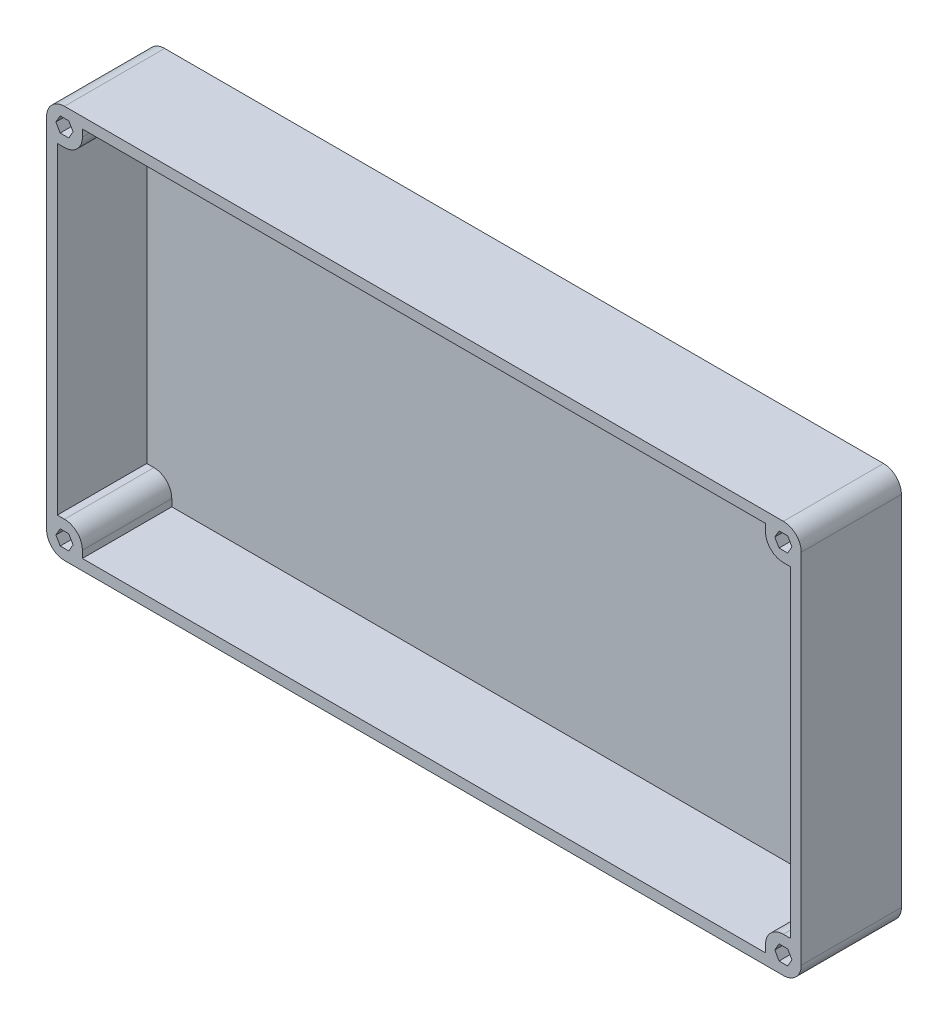
from build123d import *

# Parameters (mm, degrees)
BOSS_EXTRUDE1_DEPTH = 35.56
SHELL1_T            = -3.81
BOSS_EXTRUDE2_REACH = 306.284
SKETCH2_R           = 1.5875
CUT_EXTRUDE1_DEPTH  = 5.08


with BuildPart() as part:
    # Sketch1 → Boss-Extrude1 (new body)
    with BuildSketch(Plane.XY):
        with BuildLine():
            Line((6.35, 0), (261.62, 0))
            ThreePointArc((261.62, 0), (266.110128061, 1.859871939), (267.97, 6.35))
            Line((267.97, 6.35), (267.97, 133.35))
            ThreePointArc((267.97, 133.35), (266.110128061, 137.840128061), (261.62, 139.7))
            Line((261.62, 139.7), (6.35, 139.7))
            ThreePointArc((6.35, 139.7), (1.859871939, 137.840128061), (0, 133.35))
            Line((0, 133.35), (0, 6.35))
            ThreePointArc((0, 6.35), (1.859871939, 1.859871939), (6.35, 0))
        make_face()
    extrude(amount=BOSS_EXTRUDE1_DEPTH)

    # Shell1
    shell1_openings = [part.faces().sort_by_distance(p)[0] for p in [
        (133.985, 69.85, 35.56),
    ]]
    offset(amount=SHELL1_T, openings=shell1_openings, kind=Kind.INTERSECTION)

    # Sketch2 → Boss-Extrude2 (add, up to next)
    with BuildSketch(Plane.XY.offset(35.56), mode=Mode.PRIVATE) as boss_extrude2_sk1:
        with BuildLine():
            Line((255.27, 139.7), (261.62, 139.7))
            ThreePointArc((261.62, 139.7), (266.110128061, 137.840128061), (267.97, 133.35))
            Line((267.97, 133.35), (267.97, 127))
            Line((267.97, 127), (261.62, 127))
            ThreePointArc((261.62, 127), (257.129871939, 128.859871939), (255.27, 133.35))
            Line((255.27, 133.35), (255.27, 139.7))
        make_face()
        with Locations(Location((261.62, 133.35, 0), (0, 0, 180))):
            Circle(SKETCH2_R, mode=Mode.SUBTRACT)
    boss_extrude2_tool1 = extrude(boss_extrude2_sk1.sketch, amount=-BOSS_EXTRUDE2_REACH, mode=Mode.PRIVATE) - part.part
    # Sketch2 → Boss-Extrude2 (add, up to next)
    with BuildSketch(Plane.XY.offset(35.56), mode=Mode.PRIVATE) as boss_extrude2_sk2:
        with BuildLine():
            Line((12.7, 133.35), (12.7, 139.7))
            Line((12.7, 139.7), (6.35, 139.7))
            ThreePointArc((6.35, 139.7), (1.859871939, 137.840128061), (0, 133.35))
            Line((0, 133.35), (0, 127))
            Line((0, 127), (6.35, 127))
            ThreePointArc((6.35, 127), (10.840128061, 128.859871939), (12.7, 133.35))
        make_face()
        with Locations((6.35, 133.35)):
            Circle(SKETCH2_R, mode=Mode.SUBTRACT)
    boss_extrude2_tool2 = extrude(boss_extrude2_sk2.sketch, amount=-BOSS_EXTRUDE2_REACH, mode=Mode.PRIVATE) - part.part
    # Sketch2 → Boss-Extrude2 (add, up to next)
    with BuildSketch(Plane.XY.offset(35.56), mode=Mode.PRIVATE) as boss_extrude2_sk3:
        with BuildLine():
            Line((12.7, 0), (6.35, 0))
            ThreePointArc((6.35, 0), (1.859871939, 1.859871939), (0, 6.35))
            Line((0, 6.35), (0, 12.7))
            Line((0, 12.7), (6.35, 12.7))
            ThreePointArc((6.35, 12.7), (10.840128061, 10.840128061), (12.7, 6.35))
            Line((12.7, 6.35), (12.7, 0))
        make_face()
        with Locations(Location((6.35, 6.35, 0), (0, 0, 180))):
            Circle(SKETCH2_R, mode=Mode.SUBTRACT)
    boss_extrude2_tool3 = extrude(boss_extrude2_sk3.sketch, amount=-BOSS_EXTRUDE2_REACH, mode=Mode.PRIVATE) - part.part
    # Sketch2 → Boss-Extrude2 (add, up to next)
    with BuildSketch(Plane.XY.offset(35.56), mode=Mode.PRIVATE) as boss_extrude2_sk4:
        with BuildLine():
            Line((255.27, 6.35), (255.27, 0))
            Line((255.27, 0), (261.62, 0))
            ThreePointArc((261.62, 0), (266.110128061, 1.859871939), (267.97, 6.35))
            Line((267.97, 6.35), (267.97, 12.7))
            Line((267.97, 12.7), (261.62, 12.7))
            ThreePointArc((261.62, 12.7), (257.129871939, 10.840128061), (255.27, 6.35))
        make_face()
        with Locations((261.62, 6.35)):
            Circle(SKETCH2_R, mode=Mode.SUBTRACT)
    boss_extrude2_tool4 = extrude(boss_extrude2_sk4.sketch, amount=-BOSS_EXTRUDE2_REACH, mode=Mode.PRIVATE) - part.part
    add(boss_extrude2_tool1.solids().sort_by_distance((258.445, 139.520395, 35.56))[0])
    add(boss_extrude2_tool2.solids().sort_by_distance((12.520395, 136.525, 35.56))[0])
    add(boss_extrude2_tool3.solids().sort_by_distance((12.520395, 3.175, 35.56))[0])
    add(boss_extrude2_tool4.solids().sort_by_distance((257.256872, 10.713128, 35.56))[0])

    # Sketch3 → Cut-Extrude1 (cut)
    with BuildSketch(Plane.XY.offset(35.56)):
        Polygon((9.398, 133.35), (7.874, 135.989645431), (4.826, 135.989645431), (3.302, 133.35), (4.826, 130.710354569), (7.874, 130.710354569), align=None)
        Polygon((258.572, 133.35), (260.096, 130.710354569), (263.144, 130.710354569), (264.668, 133.35), (263.144, 135.989645431), (260.096, 135.989645431), align=None)
        Polygon((264.668, 6.35), (263.144, 8.989645431), (260.096, 8.989645431), (258.572, 6.35), (260.096, 3.710354569), (263.144, 3.710354569), align=None)
        Polygon((9.398, 6.35), (7.874, 8.989645431), (4.826, 8.989645431), (3.302, 6.35), (4.826, 3.710354569), (7.874, 3.710354569), align=None)
    extrude(amount=-CUT_EXTRUDE1_DEPTH, mode=Mode.SUBTRACT)


solid = part.part
